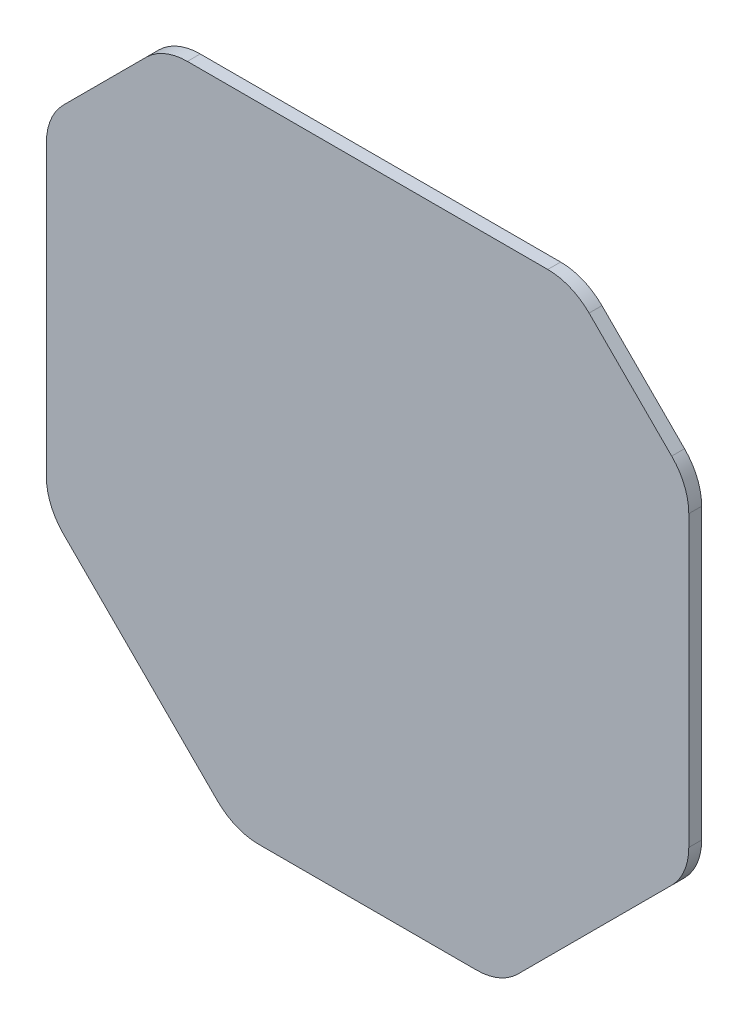
from build123d import *

# Parameters (mm, degrees)
BOSS_EXTRUDE1_DEPTH = 5.588


with BuildPart() as part:
    # Sketch1 → Boss-Extrude1 (new body)
    with BuildSketch(Plane.XY):
        with BuildLine():
            Line((65.305122421, -132.260512242), (132.260512242, -65.305122421))
            ThreePointArc((132.260512242, -65.305122421), (137.766540126, -57.064769361), (139.7, -47.344610179))
            Line((139.7, -47.344610179), (139.7, 78.378975516))
            ThreePointArc((139.7, 78.378975516), (137.766540126, 88.099134698), (132.260512242, 96.339487758))
            Line((132.260512242, 96.339487758), (96.339487758, 132.260512242))
            ThreePointArc((96.339487758, 132.260512242), (88.099134698, 137.766540126), (78.378975516, 139.7))
            Line((78.378975516, 139.7), (-78.378975516, 139.7))
            ThreePointArc((-78.378975516, 139.7), (-88.099134698, 137.766540126), (-96.339487758, 132.260512242))
            Line((-96.339487758, 132.260512242), (-132.260512242, 96.339487758))
            ThreePointArc((-132.260512242, 96.339487758), (-137.766540126, 88.099134698), (-139.7, 78.378975516))
            Line((-139.7, 78.378975516), (-139.7, -47.344610179))
            ThreePointArc((-139.7, -47.344610179), (-137.766540126, -57.064769361), (-132.260512242, -65.305122421))
            Line((-132.260512242, -65.305122421), (-65.305122421, -132.260512242))
            ThreePointArc((-65.305122421, -132.260512242), (-57.064769361, -137.766540126), (-47.344610179, -139.7))
            Line((-47.344610179, -139.7), (47.344610179, -139.7))
            ThreePointArc((47.344610179, -139.7), (57.064769361, -137.766540126), (65.305122421, -132.260512242))
        make_face()
    extrude(amount=BOSS_EXTRUDE1_DEPTH)


solid = part.part
